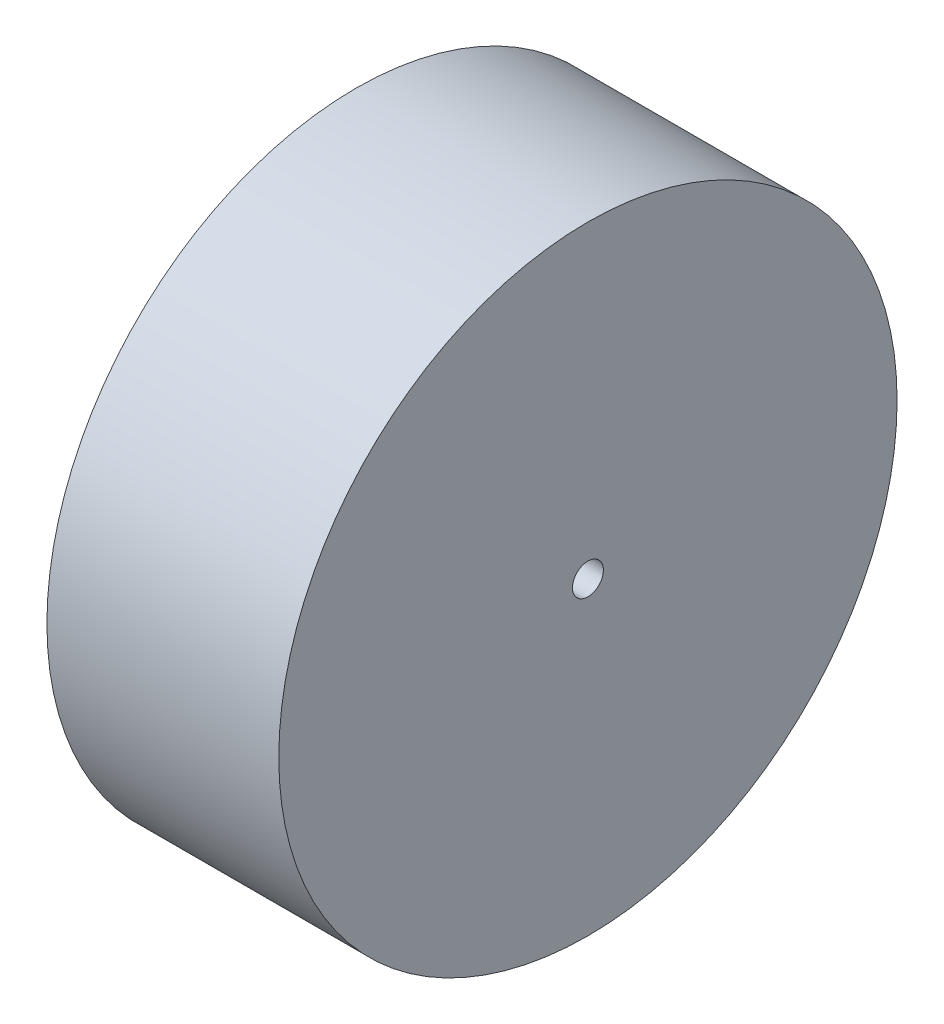
from build123d import *

# Parameters (mm, degrees)
SKETCH1_R           = 25.4
SKETCH1_R_2         = 1.27
BOSS_EXTRUDE1_DEPTH = 9.525


with BuildPart() as part:
    # Sketch1 → Boss-Extrude1 (new, symmetric)
    with BuildSketch(Plane.YZ):
        with Locations(Location((0, 0, 0), (0, 0, 90))):
            Circle(SKETCH1_R)
        with Locations(Location((0, 0, 0), (0, 0, 90))):
            Circle(SKETCH1_R_2, mode=Mode.SUBTRACT)
    extrude(amount=BOSS_EXTRUDE1_DEPTH, both=True)


solid = part.part
